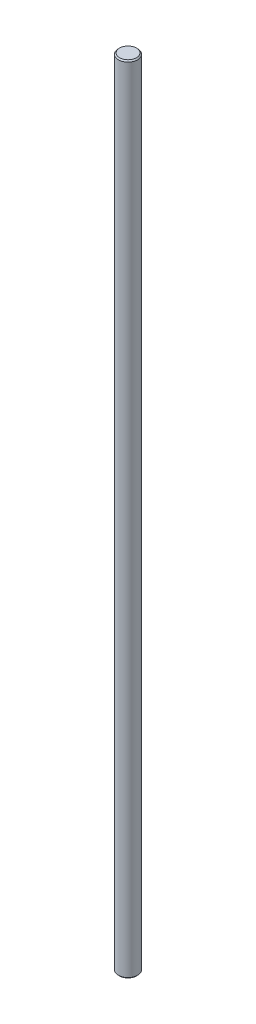
from build123d import *


with BuildPart() as part:
    # Sketch1 → Revolve1 (revolve)
    with BuildSketch(Plane.XY, mode=Mode.PRIVATE) as revolve1_sk:
        Polygon((3.5, 330), (0, 330), (0, 0), (3.5, 0), (4, 0.5), (4, 329.5), align=None)
    revolve(revolve1_sk.sketch.rotate(Axis((0, 330, 0), (0, -1, 0)), 270), axis=Axis((0, 330, 0), (0, -1, 0)))


solid = part.part
